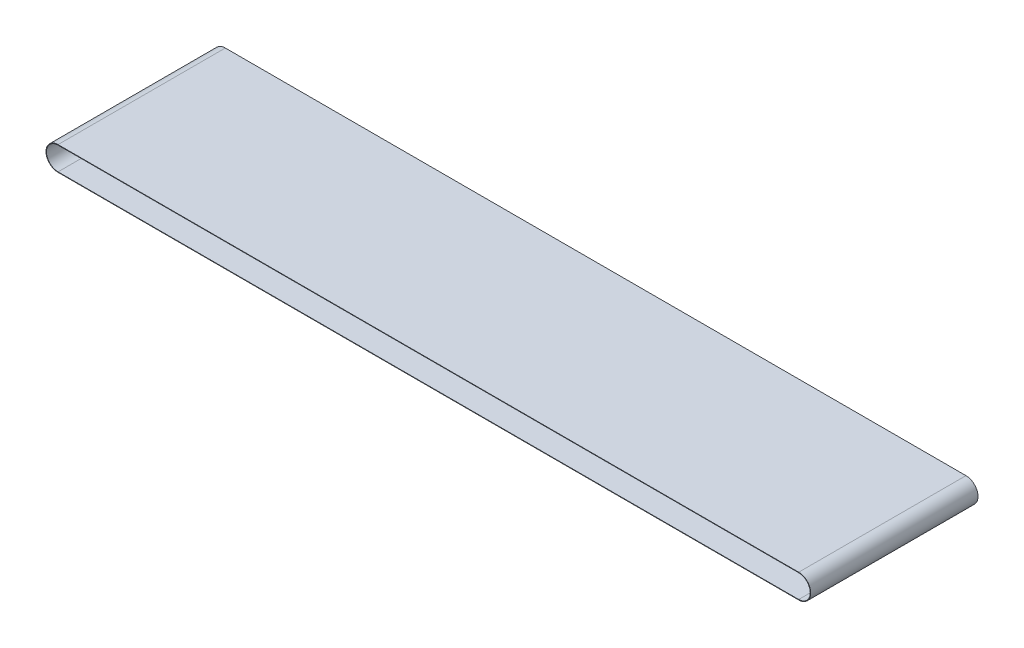
from build123d import *

# Parameters (mm, degrees)
EKSTR_ZYON_NCE1_DEPTH = 1084


with BuildPart() as part:
    # Çizim1 → Ekstrüzyon-İnce1 (new body)
    with BuildSketch(Plane.XY):
        with BuildLine():
            Line((4800, -78), (0, -78))
            ThreePointArc((0, -78), (-78, 0), (0, 78))
            Line((0, 78), (4800, 78))
            ThreePointArc((4800, 78), (4878, 0), (4800, -78))
        make_face()
        with BuildLine():
            Line((4800, -75), (0, -75))
            ThreePointArc((0, -75), (-75, 0), (0, 75))
            Line((0, 75), (4800, 75))
            ThreePointArc((4800, 75), (4875, 0), (4800, -75))
        make_face(mode=Mode.SUBTRACT)
    extrude(amount=EKSTR_ZYON_NCE1_DEPTH)


solid = part.part
